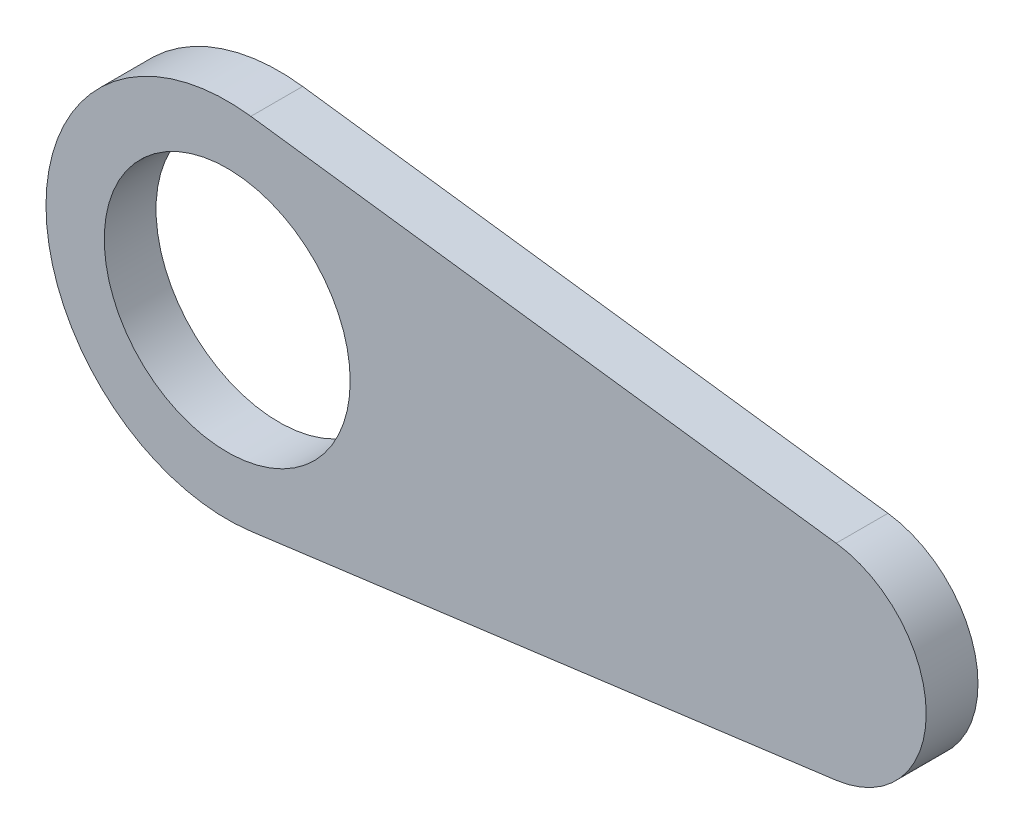
from build123d import *

# Parameters (mm, degrees)
SKETCH5_R           = 4.75
BOSS_EXTRUDE1_DEPTH = 2


with BuildPart() as part:
    # Sketch5 → Boss-Extrude1 (new body)
    with BuildSketch(Plane.XY):
        with BuildLine():
            Line((23.52173913, 3.965827566), (0.913043478, 6.94019824))
            ThreePointArc((0.913043478, 6.94019824), (-7, 0), (0.913043478, -6.94019824))
            Line((0.913043478, -6.94019824), (23.52173913, -3.965827566))
            ThreePointArc((23.52173913, -3.965827566), (27, 0), (23.52173913, 3.965827566))
        make_face()
        Circle(SKETCH5_R, mode=Mode.SUBTRACT)
    extrude(amount=BOSS_EXTRUDE1_DEPTH)


solid = part.part
